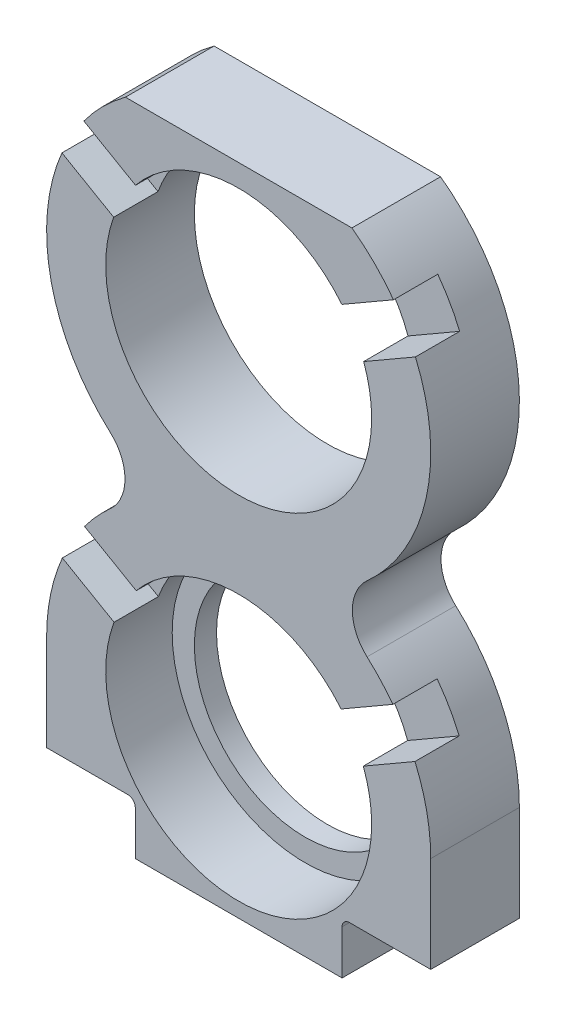
from build123d import *

# Parameters (mm, degrees)
SKETCH_1_W          = 26
SKETCH_1_H          = 46.8
EXTRUDE_1_DEPTH     = 6
SKETCH_2_R          = 9
SKETCH_2_R_2        = 7.5
CUT_EXTRUDE_1_DEPTH = 54.872441935
SKETCH_3_W          = 26
SKETCH_3_H          = 2.5
CUT_EXTRUDE_2_DEPTH = 54.872441935
CHAMFER_1_SIZE      = 5
SKETCH_4_W          = 6
SKETCH_4_H          = 6
CUT_EXTRUDE_3_DEPTH = 3.5
SKETCH_5_R          = 1.6
CUT_EXTRUDE_4_DEPTH = 3
FILLET_1_R          = 0.5
SKETCH_6_OUTSIDE_W  = 38.344
SKETCH_6_OUTSIDE_H  = 56.644
CUT_EXTRUDE_5_DEPTH = 54.872441935
FILLET_2_R          = 3
SKETCH_7_R          = 9
CUT_EXTRUDE_6_DEPTH = 4.5
CUT_EXTRUDE_7_DEPTH = 3


with BuildPart() as part:
    # 草图1 → 凸台-拉伸1 (new body)
    with BuildSketch(Plane.XY):
        with Locations((13, 23.4)):
            Rectangle(SKETCH_1_W, SKETCH_1_H)
    extrude(amount=EXTRUDE_1_DEPTH)

    # 草图2 → 切除-拉伸1 (cut, through all)
    with BuildSketch(Plane.XY.offset(6)):
        with Locations((13, 36.3)):
            Circle(SKETCH_2_R)
        with Locations((13, 12.5)):
            Circle(SKETCH_2_R_2)
    extrude(amount=-CUT_EXTRUDE_1_DEPTH, mode=Mode.SUBTRACT)

    # 草图3 → 切除-拉伸2 (cut, through all)
    with BuildSketch(Plane.XY.offset(6)):
        with Locations((13, 1.25)):
            Rectangle(SKETCH_3_W, SKETCH_3_H)
    extrude(amount=-CUT_EXTRUDE_2_DEPTH, mode=Mode.SUBTRACT)

    # 倒角1
    chamfer_1_edges = [part.edges().sort_by_distance(p)[0] for p in [
        (0, 46.8, 3),
        (26, 46.8, 3),
    ]]
    chamfer(chamfer_1_edges, length=CHAMFER_1_SIZE)

    # 草图4 → 切除-拉伸3 (cut)
    with BuildSketch(Plane.XZ.offset(-2.5)):
        with Locations((3, 3)):
            Rectangle(SKETCH_4_W, SKETCH_4_H)
        with Locations((23, 3)):
            Rectangle(SKETCH_4_W, SKETCH_4_H)
    extrude(amount=-CUT_EXTRUDE_3_DEPTH, mode=Mode.SUBTRACT)

    # 草图5 → 切除-拉伸4 (cut)
    with BuildSketch(Plane.XZ.offset(-6)):
        with Locations(Location((3, 3, 0), (0, 0, 270))):
            Circle(SKETCH_5_R)
        with Locations(Location((23, 3, 0), (0, 0, 270))):
            Circle(SKETCH_5_R)
    extrude(amount=-CUT_EXTRUDE_4_DEPTH, mode=Mode.SUBTRACT)

    # 圆角1
    fillet_1_edges = [part.edges().sort_by_distance(p)[0] for p in [
        (6, 6, 3),
        (20, 6, 3),
    ]]
    fillet(fillet_1_edges, radius=FILLET_1_R)

    # 草图6 outside → 切除-拉伸5 (cut, through all)
    with BuildSketch(Plane.XY.offset(6)):
        with Locations((13, 24.65)):
            Rectangle(SKETCH_6_OUTSIDE_W, SKETCH_6_OUTSIDE_H)
        with BuildLine():
            Line((0, 12.5), (0, 6))
            Line((0, 6), (0, 0))
            Line((0, 0), (26, 0))
            Line((26, 0), (26, 6))
            Line((26, 6), (26, 12.5))
            ThreePointArc((26, 12.5), (23.886599408, 19.605065328), (18.233545643, 24.4))
            ThreePointArc((18.233545643, 24.4), (13, 49.3), (7.766454357, 24.4))
            ThreePointArc((7.766454357, 24.4), (2.113400592, 19.605065328), (0, 12.5))
        make_face(mode=Mode.SUBTRACT)
    extrude(amount=-CUT_EXTRUDE_5_DEPTH, mode=Mode.SUBTRACT)

    # 圆角2
    fillet_2_edges = [part.edges().sort_by_distance(p)[0] for p in [
        (18.233545643, 24.4, 3),
        (7.766454357, 24.4, 3),
    ]]
    fillet(fillet_2_edges, radius=FILLET_2_R)

    # 草图7 → 切除-拉伸6 (cut)
    with BuildSketch(Plane.XY.offset(6)):
        with Locations((13, 12.5)):
            Circle(SKETCH_7_R)
    extrude(amount=-CUT_EXTRUDE_6_DEPTH, mode=Mode.SUBTRACT)

    # 草图8 → 切除-拉伸7 (cut)
    with BuildSketch(Plane.XY.offset(6)):
        Polygon((5.159136754, 39.007700761), (6.659136754, 41.605776972), (1.007687062, 44.868642973), (-0.492312938, 42.270566762), align=None)
        Polygon((7.841745639, 13.746068736), (9.341745639, 16.344144947), (1.5, 20.871578903), (0, 18.273502692), align=None)
        Polygon((24.5, 20.871578903), (16.658254361, 16.344144947), (18.158254361, 13.746068736), (26, 18.273502692), align=None)
        Polygon((24.992312938, 44.868642973), (19.340863246, 41.605776972), (20.840863246, 39.007700761), (26.492312938, 42.270566762), align=None)
    extrude(amount=-CUT_EXTRUDE_7_DEPTH, mode=Mode.SUBTRACT)


solid = part.part
